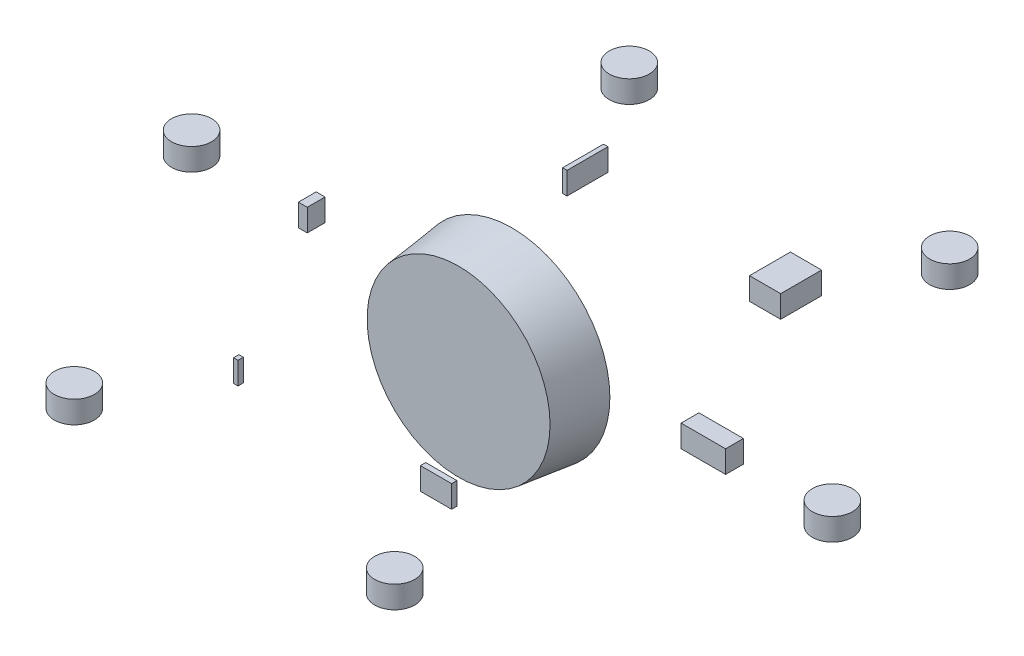
from build123d import *

# Parameters (mm, degrees)
SKETCH1_R              = 220
BOSS_EXTRUDE1_DEPTH    = 120
BOSS_EXTRUDE1_TAPER    = 6.875493542
SKETCH2_R              = 45
BOSS_EXTRUDE2_DEPTH    = 50
BOSS_EXTRUDE2_2_DEPTH  = 50
BOSS_EXTRUDE2_3_DEPTH  = 50
BOSS_EXTRUDE2_4_DEPTH  = 50
BOSS_EXTRUDE2_5_DEPTH  = 50
BOSS_EXTRUDE2_6_DEPTH  = 50
SKETCH2_W              = 100
SKETCH2_H              = 40
BOSS_EXTRUDE2_7_DEPTH  = 50
SKETCH2_W_2            = 70
SKETCH2_H_2            = 91.961524228
BOSS_EXTRUDE2_8_DEPTH  = 50
SKETCH2_W_3            = 10
BOSS_EXTRUDE2_9_DEPTH  = 50
SKETCH2_W_4            = 20
BOSS_EXTRUDE2_10_DEPTH = 50
SKETCH2_H_3            = 11.961524228
BOSS_EXTRUDE2_11_DEPTH = 50
BOSS_EXTRUDE2_12_DEPTH = 50


with BuildPart() as part:
    # Sketch1 → Boss-Extrude1 (new body)
    with BuildSketch(Plane.XY):
        Circle(SKETCH1_R)
    extrude(amount=BOSS_EXTRUDE1_DEPTH, taper=BOSS_EXTRUDE1_TAPER)


with BuildPart() as body_2:
    # Sketch2 → Boss-Extrude2 (new body)
    with BuildSketch(Plane(origin=(0, 0, 0), x_dir=(1, 0, 0), z_dir=(0, 1, 0))):
        with Locations(Location((720, 0, 0), (0, 0, 270))):
            Circle(SKETCH2_R)
    extrude(amount=BOSS_EXTRUDE2_DEPTH)


with BuildPart() as body_3:
    # Sketch2 → Boss-Extrude2 2 (new body)
    with BuildSketch(Plane(origin=(0, 0, 0), x_dir=(1, 0, 0), z_dir=(0, 1, 0))):
        with Locations(Location((360, 623.538290725, 0), (0, 0, 270))):
            Circle(SKETCH2_R)
    extrude(amount=BOSS_EXTRUDE2_2_DEPTH)


with BuildPart() as body_4:
    # Sketch2 → Boss-Extrude2 3 (new body)
    with BuildSketch(Plane(origin=(0, 0, 0), x_dir=(1, 0, 0), z_dir=(0, 1, 0))):
        with Locations(Location((-360, 623.538290725, 0), (0, 0, 270))):
            Circle(SKETCH2_R)
    extrude(amount=BOSS_EXTRUDE2_3_DEPTH)


with BuildPart() as body_5:
    # Sketch2 → Boss-Extrude2 4 (new body)
    with BuildSketch(Plane(origin=(0, 0, 0), x_dir=(1, 0, 0), z_dir=(0, 1, 0))):
        with Locations(Location((-720, 0, 0), (0, 0, 270))):
            Circle(SKETCH2_R)
    extrude(amount=BOSS_EXTRUDE2_4_DEPTH)


with BuildPart() as body_6:
    # Sketch2 → Boss-Extrude2 5 (new body)
    with BuildSketch(Plane(origin=(0, 0, 0), x_dir=(1, 0, 0), z_dir=(0, 1, 0))):
        with Locations(Location((-360, -623.538290725, 0), (0, 0, 270))):
            Circle(SKETCH2_R)
    extrude(amount=BOSS_EXTRUDE2_5_DEPTH)


with BuildPart() as body_7:
    # Sketch2 → Boss-Extrude2 6 (new body)
    with BuildSketch(Plane(origin=(0, 0, 0), x_dir=(1, 0, 0), z_dir=(0, 1, 0))):
        with Locations(Location((360, -623.538290725, 0), (0, 0, 270))):
            Circle(SKETCH2_R)
    extrude(amount=BOSS_EXTRUDE2_6_DEPTH)


with BuildPart() as body_8:
    # Sketch2 → Boss-Extrude2 7 (new body)
    with BuildSketch(Plane(origin=(0, 0, 0), x_dir=(1, 0, 0), z_dir=(0, 1, 0))):
        with Locations((450, 0)):
            Rectangle(SKETCH2_W, SKETCH2_H)
    extrude(amount=BOSS_EXTRUDE2_7_DEPTH)


with BuildPart() as body_9:
    # Sketch2 → Boss-Extrude2 8 (new body)
    with BuildSketch(Plane(origin=(0, 0, 0), x_dir=(1, 0, 0), z_dir=(0, 1, 0))):
        with Locations((225, 389.711431703)):
            Rectangle(SKETCH2_W_2, SKETCH2_H_2)
    extrude(amount=BOSS_EXTRUDE2_8_DEPTH)


with BuildPart() as body_10:
    # Sketch2 → Boss-Extrude2 9 (new body)
    with BuildSketch(Plane(origin=(0, 0, 0), x_dir=(1, 0, 0), z_dir=(0, 1, 0))):
        with Locations((-225, 389.711431703)):
            Rectangle(SKETCH2_W_3, SKETCH2_H_2)
    extrude(amount=BOSS_EXTRUDE2_9_DEPTH)


with BuildPart() as body_11:
    # Sketch2 → Boss-Extrude2 10 (new body)
    with BuildSketch(Plane(origin=(0, 0, 0), x_dir=(1, 0, 0), z_dir=(0, 1, 0))):
        with Locations((-450, 0)):
            Rectangle(SKETCH2_W_4, SKETCH2_H)
    extrude(amount=BOSS_EXTRUDE2_10_DEPTH)


with BuildPart() as body_12:
    # Sketch2 → Boss-Extrude2 11 (new body)
    with BuildSketch(Plane(origin=(0, 0, 0), x_dir=(1, 0, 0), z_dir=(0, 1, 0))):
        with Locations((-225, -389.711431703)):
            Rectangle(SKETCH2_W_3, SKETCH2_H_3)
    extrude(amount=BOSS_EXTRUDE2_11_DEPTH)


with BuildPart() as body_13:
    # Sketch2 → Boss-Extrude2 12 (new body)
    with BuildSketch(Plane(origin=(0, 0, 0), x_dir=(1, 0, 0), z_dir=(0, 1, 0))):
        with Locations((225, -389.711431703)):
            Rectangle(SKETCH2_W_2, SKETCH2_H_3)
    extrude(amount=BOSS_EXTRUDE2_12_DEPTH)


solid = Compound([part.part, body_2.part, body_3.part, body_4.part, body_5.part, body_6.part, body_7.part, body_8.part, body_9.part, body_10.part, body_11.part, body_12.part, body_13.part])
